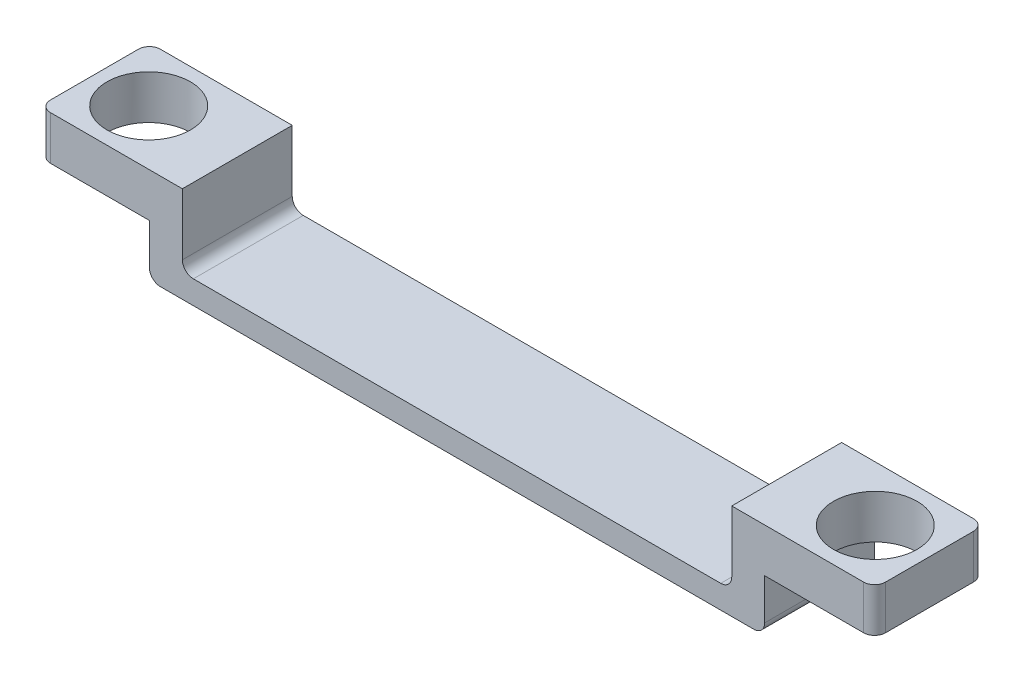
from build123d import *

# Parameters (mm, degrees)
BOSS_EXTRU_1_DEPTH      = 5
BOSS_EXTRU_2_DEPTH      = 2
ESQUISSE4_R             = 1.9
ENL_V_MAT_EXTRU_1_DEPTH = 5


with BuildPart() as part:
    # Esquisse2 → Boss.-Extru.1 (new body)
    with BuildSketch(Plane.XY):
        with BuildLine():
            Line((-5.621162791, 2.893255814), (-4.121162791, 2.893255814))
            Line((-4.121162791, 2.893255814), (-4.121162791, 0.093255814))
            ThreePointArc((-4.121162791, 0.093255814), (-3.974716181, -0.260297577), (-3.621162791, -0.406744186))
            Line((-3.621162791, -0.406744186), (20.378837209, -0.406744186))
            ThreePointArc((20.378837209, -0.406744186), (20.7323906, -0.260297577), (20.878837209, 0.093255814))
            Line((20.878837209, 0.093255814), (20.878837209, 2.893255814))
            Line((20.878837209, 2.893255814), (22.378837209, 2.893255814))
            Line((22.378837209, 2.893255814), (22.378837209, -0.965813953))
            ThreePointArc((22.378837209, -0.965813953), (22.2323906, -1.319367344), (21.878837209, -1.465813953))
            Line((21.878837209, -1.465813953), (-5.121162791, -1.465813953))
            ThreePointArc((-5.121162791, -1.465813953), (-5.474716181, -1.319367344), (-5.621162791, -0.965813953))
            Line((-5.621162791, -0.965813953), (-5.621162791, 2.893255814))
        make_face()
    extrude(amount=BOSS_EXTRU_1_DEPTH)

    # Esquisse3 → Boss.-Extru.2 (add)
    with BuildSketch(Plane(origin=(0, 2.893255814, 0), x_dir=(1, 0, 0), z_dir=(0, 1, 0))):
        with BuildLine():
            Line((-5.621162791, 0), (-10.121162791, 0))
            ThreePointArc((-10.121162791, 0), (-10.474716181, -0.146446609), (-10.621162791, -0.5))
            Line((-10.621162791, -0.5), (-10.621162791, -4.5))
            ThreePointArc((-10.621162791, -4.5), (-10.474716181, -4.853553391), (-10.121162791, -5))
            Line((-10.121162791, -5), (-5.621162791, -5))
            Line((-5.621162791, -5), (-5.621162791, 0))
        make_face()
        with BuildLine():
            Line((22.378837209, -5), (26.878837209, -5))
            ThreePointArc((26.878837209, -5), (27.2323906, -4.853553391), (27.378837209, -4.5))
            Line((27.378837209, -4.5), (27.378837209, -0.5))
            ThreePointArc((27.378837209, -0.5), (27.2323906, -0.146446609), (26.878837209, 0))
            Line((26.878837209, 0), (22.378837209, 0))
            Line((22.378837209, 0), (22.378837209, -5))
        make_face()
    extrude(amount=-BOSS_EXTRU_2_DEPTH)

    # Esquisse4 → Enlèv. mat.-Extru.1 (cut)
    with BuildSketch(Plane(origin=(0, 2.893255814, 0), x_dir=(1, 0, 0), z_dir=(0, 1, 0))):
        with Locations(Location((-8.153362247, -2.5, 0), (0, 0, 270))):
            Circle(ESQUISSE4_R)
        with Locations(Location((24.911036665, -2.5, 0), (0, 0, 270))):
            Circle(ESQUISSE4_R)
    extrude(amount=-ENL_V_MAT_EXTRU_1_DEPTH, mode=Mode.SUBTRACT)


solid = part.part
